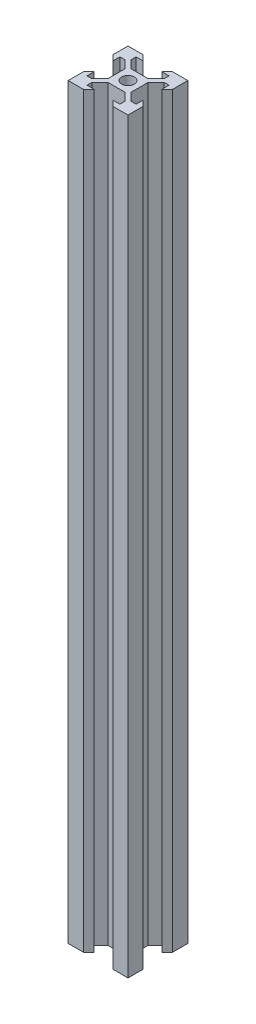
from build123d import *

# Parameters (mm, degrees)
SKETCH1_R           = 2.1
BOSS_EXTRUDE1_DEPTH = 250


with BuildPart() as part:
    # Sketch1 → Boss-Extrude1 (new body)
    with BuildSketch(Plane(origin=(0, 0, 0), x_dir=(1, 0, 0), z_dir=(0, 1, 0))):
        Polygon((-3.900660172, -2.84), (-3.900660172, 0), (-3.900660172, 2.84), (-6.56, 5.499339828), (-8.2, 5.499339828), (-8.2, 3.1), (-10, 4.9), (-10, 10), (-4.9, 10), (-3.1, 8.2), (-5.499339828, 8.2), (-5.499339828, 6.56), (-2.84, 3.900660172), (0, 3.900660172), (2.84, 3.900660172), (5.499339828, 6.56), (5.499339828, 8.2), (3.1, 8.2), (4.9, 10), (10, 10), (10, 4.9), (8.2, 3.1), (8.2, 5.499339828), (6.56, 5.499339828), (3.900660172, 2.84), (3.900660172, 0), (3.900660172, -2.84), (6.56, -5.499339828), (8.2, -5.499339828), (8.2, -3.1), (10, -4.9), (10, -10), (4.9, -10), (3.1, -8.2), (5.499339828, -8.2), (5.499339828, -6.56), (2.84, -3.900660172), (0, -3.900660172), (-2.84, -3.900660172), (-5.499339828, -6.56), (-5.499339828, -8.2), (-3.1, -8.2), (-4.9, -10), (-10, -10), (-10, -4.9), (-8.2, -3.1), (-8.2, -5.499339828), (-6.56, -5.499339828), align=None)
        with Locations(Location((0, 0, 0), (0, 0, 270))):
            Circle(SKETCH1_R, mode=Mode.SUBTRACT)
    extrude(amount=BOSS_EXTRUDE1_DEPTH)


solid = part.part
